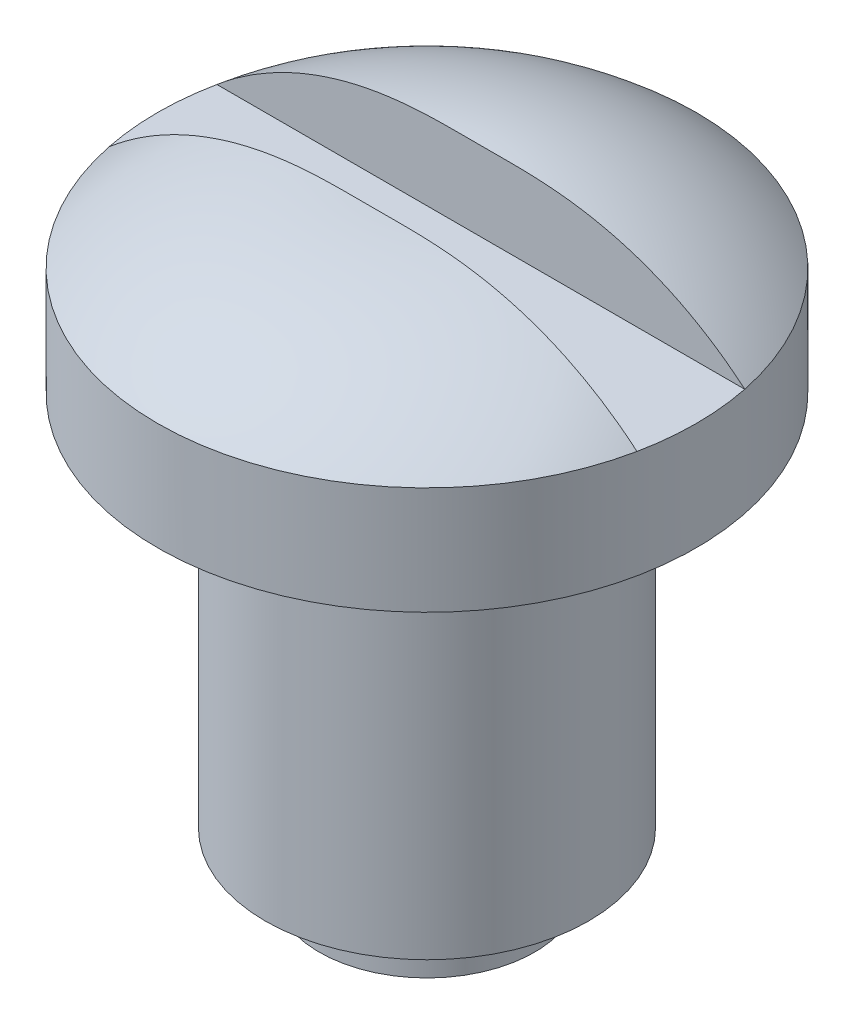
from build123d import *

# Parameters (mm, degrees)
CUT_EXTRUDE6_DEPTH = 10


with BuildPart() as part:
    # Sketch1 → Revolve2 (revolve)
    with BuildSketch(Plane.XY):
        with BuildLine():
            Line((0, 6.102087539), (0, -3.366129571))
            Line((0, -3.366129571), (0, -4.366129571))
            Line((0, -4.366129571), (-2, -4.366129571))
            Line((-2, -4.366129571), (-2, -3.366129571))
            Line((-2, -3.366129571), (-3, -3.366129571))
            Line((-3, -3.366129571), (-3, 3.633870429))
            Line((-3, 3.633870429), (-5, 3.633870429))
            Line((-5, 3.633870429), (-5, 5.633870429))
            ThreePointArc((-5, 5.633870429), (-3.134722719, 6.735016577), (-1, 7.102087539))
            Line((-1, 7.102087539), (-1, 6.102087539))
            Line((-1, 6.102087539), (0, 6.102087539))
        make_face()
    revolve(axis=Axis((0, 6.102087539, 0), (0, -1, 0)))

    # Sketch2 → Cut-Extrude6 (cut)
    with BuildSketch(Plane.ZY.offset(5)):
        Polygon((-1, 7.153918726), (-1, 7.78774413), (1, 7.78774413), (1, 7.102087539), (1, 5.633870429), (-1, 5.633870429), (-1, 7.102087539), align=None)
    extrude(amount=-CUT_EXTRUDE6_DEPTH, mode=Mode.SUBTRACT)


solid = part.part
